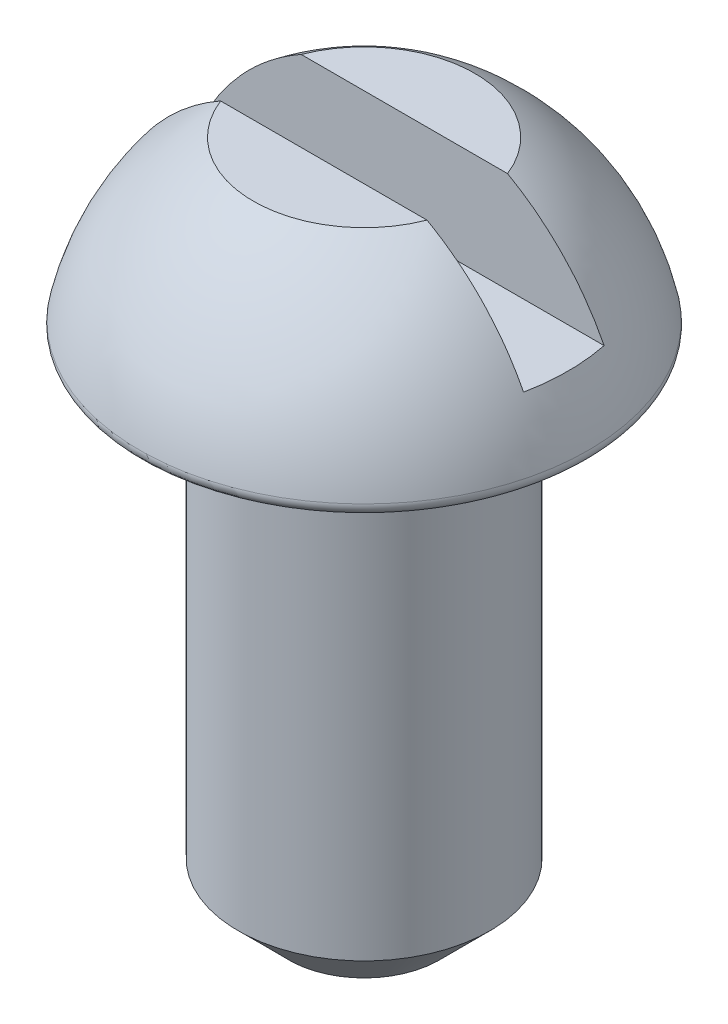
from build123d import *

# Parameters (mm, degrees)
FILLET_1_R          = 0.1
SKETCH_3_W          = 5
SKETCH_3_H          = 0.8
CUT_EXTRUDE_2_DEPTH = 1


with BuildPart() as part:
    # Эскиз1 → Повернуть1 (revolve)
    with BuildSketch(Plane.XY):
        with BuildLine():
            Line((2.25, 5), (1.25, 5))
            Line((1.25, 5), (1.25, 0.5))
            Line((1.25, 0.5), (0.75, 0))
            Line((0.75, 0), (0, 0))
            Line((0, 0), (0, 6.7))
            Line((0, 6.7), (1.1, 6.7))
            ThreePointArc((1.1, 6.7), (1.861991249, 5.97649408), (2.25, 5))
        make_face()
    revolve(axis=Axis((0, 0, 0), (0, 1, 0)))

    # Скругление1
    fillet_1_edges = [part.edges().sort_by_distance(p)[0] for p in [
        (-2.25, 5, 0),
    ]]
    fillet(fillet_1_edges, radius=FILLET_1_R)

    # Эскиз3 → Вырез-Вытянуть2 (cut)
    with BuildSketch(Plane(origin=(0, 6.7, 0), x_dir=(-1, 0, 0), z_dir=(0, 1, 0))):
        Rectangle(SKETCH_3_W, SKETCH_3_H)
    extrude(amount=-CUT_EXTRUDE_2_DEPTH, mode=Mode.SUBTRACT)


solid = part.part
